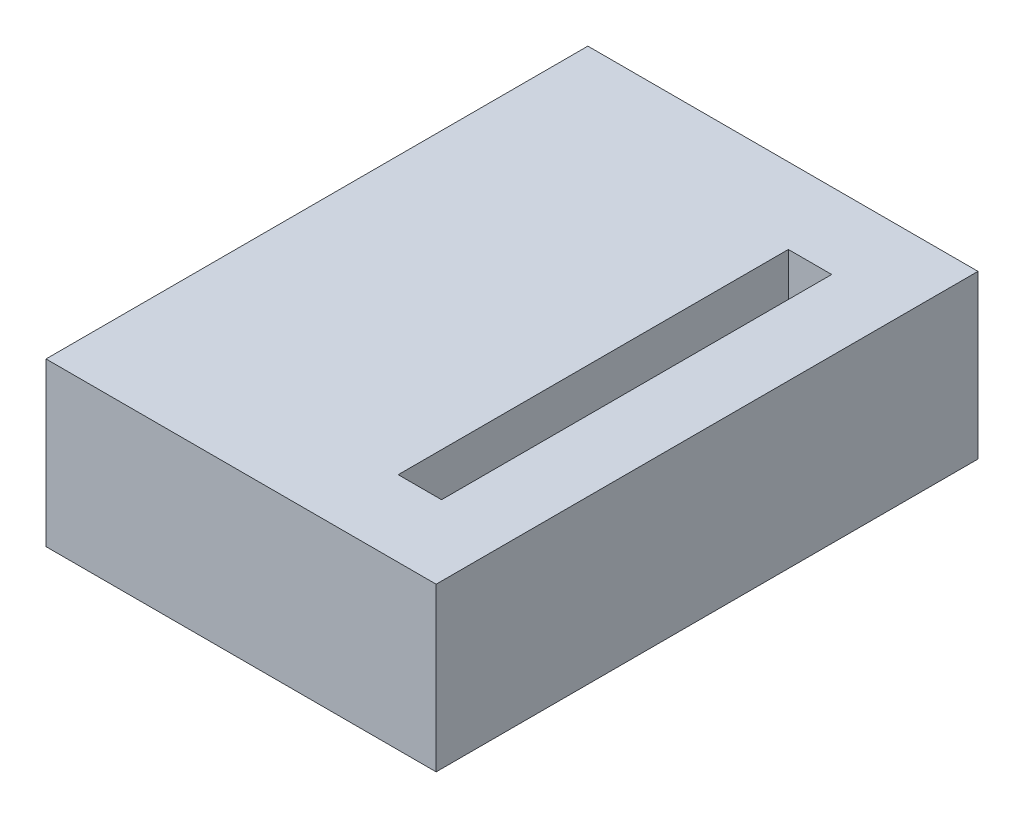
from build123d import *

# Parameters (mm, degrees)
SKETCH2_W           = 9.144
SKETCH2_H           = 12.7
BOSS_EXTRUDE1_DEPTH = 3.81
SKETCH4_W           = 1.016
SKETCH4_H           = 9.144
CUT_EXTRUDE1_DEPTH  = 17.106484284


with BuildPart() as part:
    # Sketch2 → Boss-Extrude1 (new body)
    with BuildSketch(Plane(origin=(0, 0, 0), x_dir=(1, 0, 0), z_dir=(0, 1, 0))):
        with Locations((4.572, 6.35)):
            Rectangle(SKETCH2_W, SKETCH2_H)
    extrude(amount=BOSS_EXTRUDE1_DEPTH)

    # Sketch4 → Cut-Extrude1 (cut, through all)
    with BuildSketch(Plane(origin=(0, 3.81, 0), x_dir=(1, 0, 0), z_dir=(0, 1, 0))):
        with Locations((6.985, 6.35)):
            Rectangle(SKETCH4_W, SKETCH4_H)
    extrude(amount=-CUT_EXTRUDE1_DEPTH, mode=Mode.SUBTRACT)


solid = part.part
